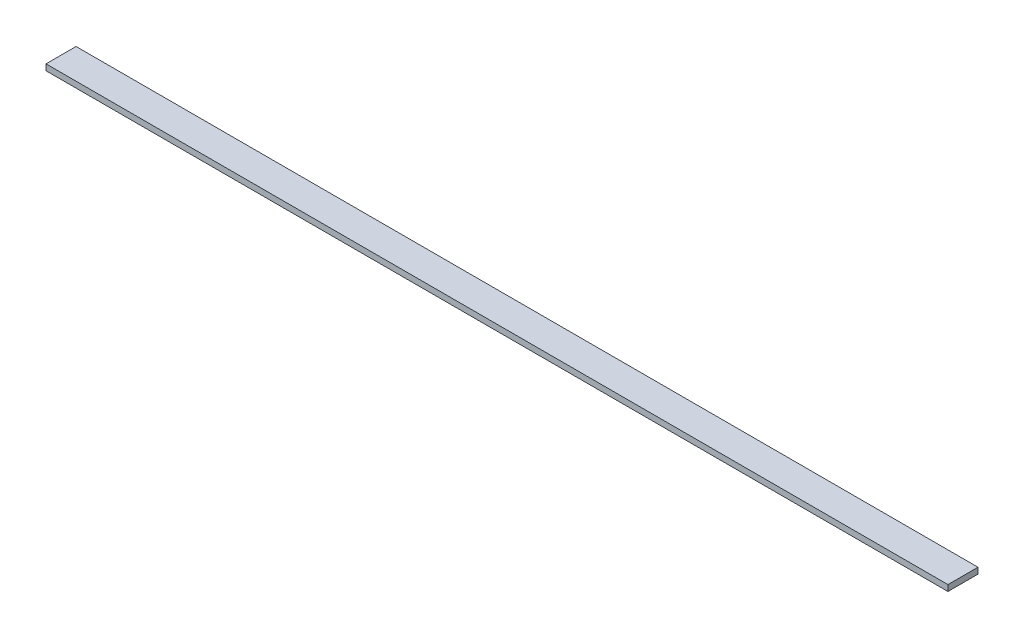
from build123d import *

# Parameters (mm, degrees)
ESQUISSE1_W        = 600
ESQUISSE1_H        = 20
BOSS_EXTRU_1_DEPTH = 2


with BuildPart() as part:
    # Esquisse1 → Boss.-Extru.1 (new, symmetric)
    with BuildSketch(Plane(origin=(0, 0, 0), x_dir=(1, 0, 0), z_dir=(0, 1, 0))):
        Rectangle(ESQUISSE1_W, ESQUISSE1_H)
    extrude(amount=BOSS_EXTRU_1_DEPTH, both=True)


solid = part.part
